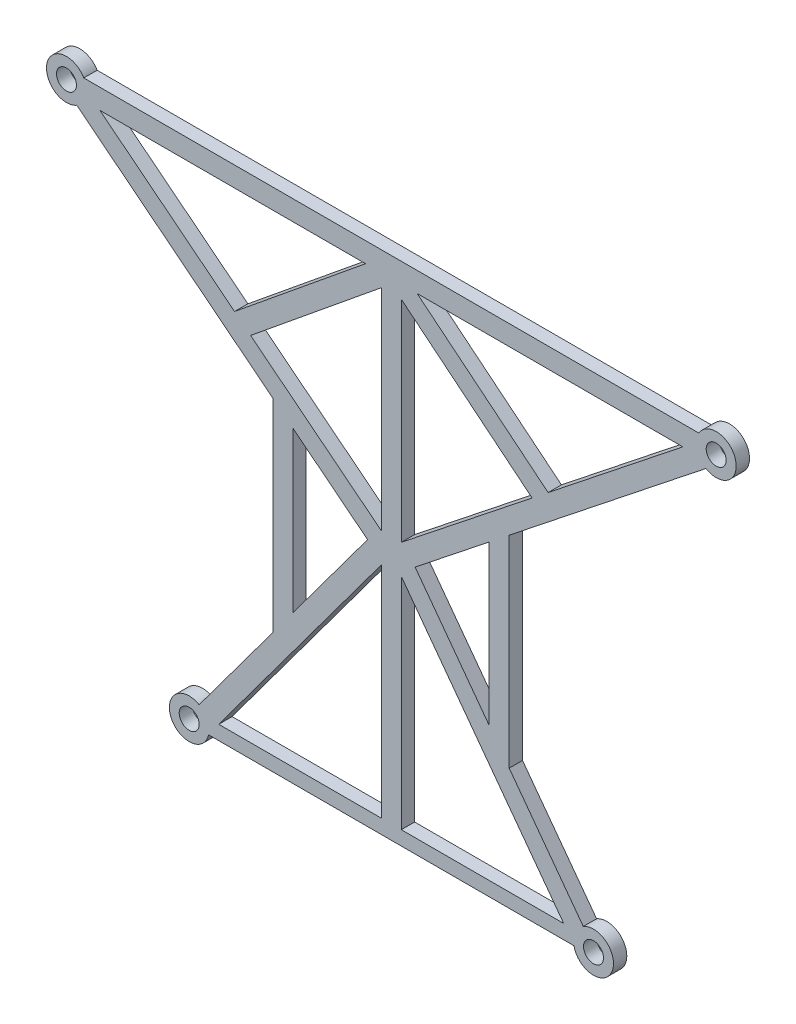
from build123d import *

# Parameters (mm, degrees)
ESBO_O1_R                = 1.5
RESSALTO_EXTRUS_O1_DEPTH = 2


with BuildPart() as part:
    # Esboço1 → Ressalto-extrusão1 (new body)
    with BuildSketch(Plane.XY):
        with BuildLine():
            Line((24.828910237, 4.947115543), (-67.47493734, 4.947115543))
            ThreePointArc((-67.47493734, 4.947115543), (-72.976635365, 4.201423413), (-68.533513234, 0.872248794))
            Line((-68.533513234, 0.872248794), (-39.094485287, -22.491099002))
            Line((-39.094485287, -22.491099002), (-39.094485287, -52.920988494))
            Line((-39.094485287, -52.920988494), (-50.165018851, -67.855248208))
            ThreePointArc((-50.165018851, -67.855248208), (-54.378358474, -71.627569421), (-48.752314099, -71.052884457))
            Line((-48.752314099, -71.052884457), (6.078910237, -71.052884457))
            ThreePointArc((6.078910237, -71.052884457), (11.761262781, -71.628269251), (7.481508074, -67.846219841))
            Line((7.481508074, -67.846219841), (-3.636404062, -52.83035158))
            Line((-3.636404062, -52.83035158), (-3.636404062, -22.558447224))
            Line((-3.636404062, -22.558447224), (25.887486132, 0.872248794))
            ThreePointArc((25.887486132, 0.872248794), (30.330608262, 4.201423413), (24.828910237, 4.947115543))
        make_face()
        with Locations((-51.658717817, -70.426041486)):
            Circle(ESBO_O1_R, mode=Mode.SUBTRACT)
        Polygon((-22.823013551, -36.008314403), (-22.823013551, -68.926041486), (-47.22441071, -68.926041486), align=None, mode=Mode.SUBTRACT)
        Polygon((-36.094485287, -24.871953544), (-24.892352245, -33.762169987), (-36.094485287, -48.873958703), align=None, mode=Mode.SUBTRACT)
        with Locations((9.012690715, -70.426041486)):
            Circle(ESBO_O1_R, mode=Mode.SUBTRACT)
        Polygon((-19.823013551, -36.010232621), (4.548209245, -68.926041486), (-19.823013551, -68.926041486), align=None, mode=Mode.SUBTRACT)
        Polygon((-21.323013551, -33.984330445), (-21.322839799, -33.984565114), (-21.323013551, -33.984799507), align=None, mode=Mode.SUBTRACT)
        Polygon((-6.636404062, -24.939301765), (-6.636404062, -48.778547228), (-17.754316199, -33.762678967), align=None, mode=Mode.SUBTRACT)
        Polygon((-42.445301093, -16.001887011), (-22.823013551, 0.011039778), (-22.823013551, -31.574491147), align=None, mode=Mode.SUBTRACT)
        with Locations((-70.073013551, 3.447115543)):
            Circle(ESBO_O1_R, mode=Mode.SUBTRACT)
        Polygon((-65.061973687, 1.947115543), (-25.195486483, 1.947115543), (-44.850847826, -14.092801389), align=None, mode=Mode.SUBTRACT)
        Polygon((-19.823013551, -31.574491147), (-19.823013551, 0.011063284), (-0.200409257, -16.00163563), align=None, mode=Mode.SUBTRACT)
        Polygon((2.205145312, -14.09254379), (-17.450497364, 1.947115543), (22.415946584, 1.947115543), align=None, mode=Mode.SUBTRACT)
        with Locations((27.426986449, 3.447115543)):
            Circle(ESBO_O1_R, mode=Mode.SUBTRACT)
    extrude(amount=RESSALTO_EXTRUS_O1_DEPTH)


solid = part.part
